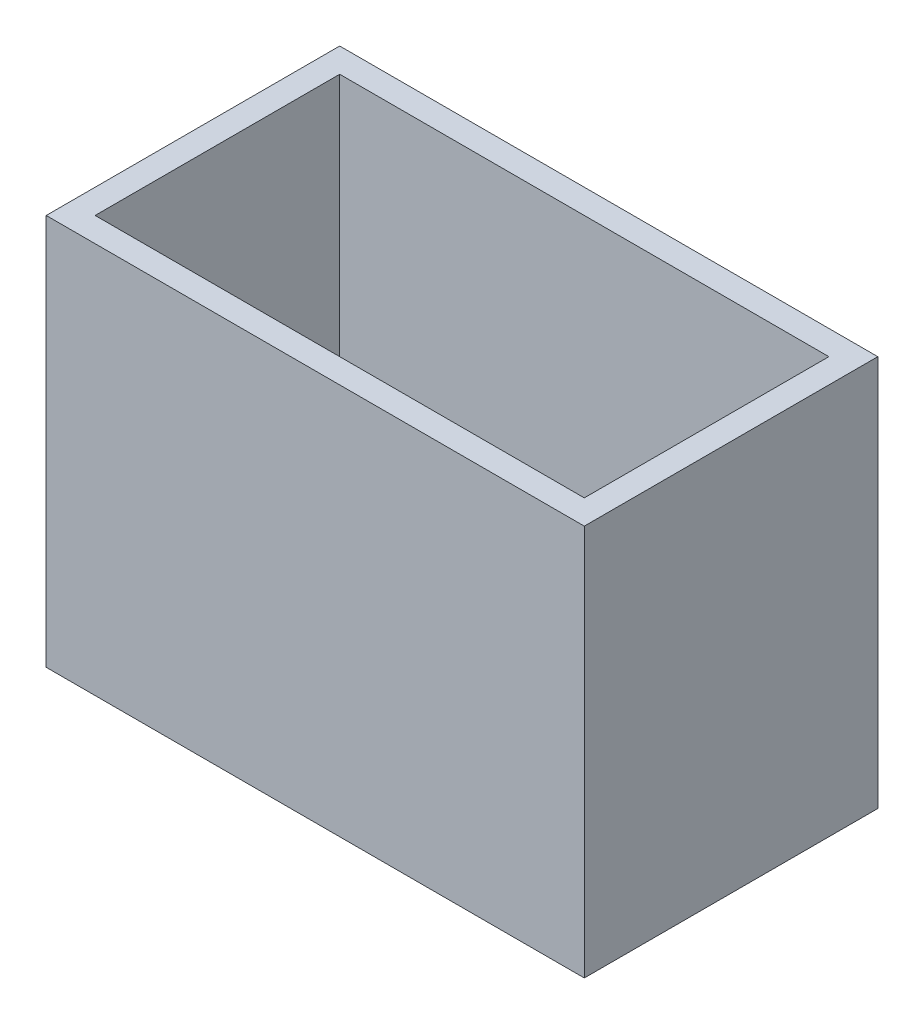
from build123d import *

# Parameters (mm, degrees)
SKETCH_1_W          = 110
SKETCH_1_H          = 60
BOSS_EXTRUDE1_DEPTH = 80
SKETCH2_W           = 100
SKETCH2_H           = 50
CUT_EXTRUDE1_DEPTH  = 75


with BuildPart() as part:
    # Sketch 1 → Boss-Extrude1 (new body)
    with BuildSketch(Plane(origin=(0, 0, 0), x_dir=(1, 0, 0), z_dir=(0, 1, 0))):
        Rectangle(SKETCH_1_W, SKETCH_1_H)
    extrude(amount=BOSS_EXTRUDE1_DEPTH)

    # Sketch2 → Cut-Extrude1 (cut)
    with BuildSketch(Plane(origin=(0, 80, 0), x_dir=(1, 0, 0), z_dir=(0, 1, 0))):
        Rectangle(SKETCH2_W, SKETCH2_H)
    extrude(amount=-CUT_EXTRUDE1_DEPTH, mode=Mode.SUBTRACT)


solid = part.part
